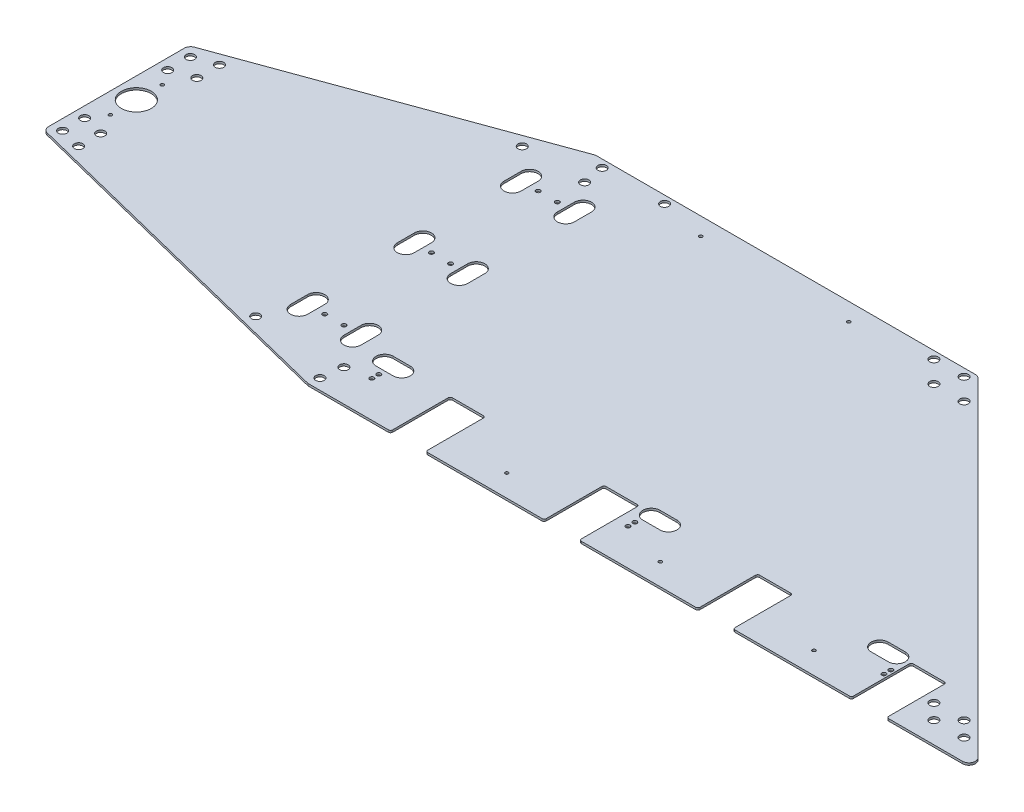
from build123d import *

# Parameters (mm, degrees)
SKETCH2_R                   = 6.35
SKETCH2_R_2                 = 2.45745
BOSS_EXTRUDE1_DEPTH         = 3.175
FILLET1_R                   = 3.175
CUT_EXTRUDE1_DEPTH          = 6.35
F_1_4_0_25_DIAMETER_HOLE1_D = 6.35
SKETCH8_R                   = 22.225
CUT_EXTRUDE2_DEPTH          = 1107.912948355
F_1_4_0_25_DIAMETER_HOLE2_D = 6.35
SKETCH12_R                  = 2.45745
SKETCH12_R_2                = 3.175
CUT_EXTRUDE3_DEPTH          = 1107.912948355


with BuildPart() as part:
    # Sketch2 → Boss-Extrude1 (new body)
    with BuildSketch(Plane(origin=(0, 0, 0), x_dir=(1, 0, 0), z_dir=(0, 1, 0))):
        with BuildLine():
            ThreePointArc((-523.9004, 138.064786013), (-521.881202428, 132.200610461), (-516.679706056, 128.82271922))
            Line((-516.679706056, 128.82271922), (-1.134783113, 0.282933207))
            ThreePointArc((-1.134783113, 0.282933207), (0.008717447, 0.070997906), (1.169522943, 0))
            Line((1.169522943, 0), (122.844814136, 0))
            Line((122.844814136, 0), (122.844814136, 88.9))
            Line((122.844814136, 88.9), (175.168814136, 88.9))
            Line((175.168814136, 88.9), (175.168814136, 0))
            Line((175.168814136, 0), (351.444814136, 0))
            Line((351.444814136, 0), (351.444814136, 88.9))
            Line((351.444814136, 88.9), (403.768814136, 88.9))
            Line((403.768814136, 88.9), (403.768814136, 0))
            Line((403.768814136, 0), (580.044814136, 0))
            Line((580.044814136, 0), (580.044814136, 88.9))
            Line((580.044814136, 88.9), (632.368814136, 88.9))
            Line((632.368814136, 88.9), (632.368814136, 0))
            Line((632.368814136, 0), (808.644814136, 0))
            Line((808.644814136, 0), (808.644814136, 88.9))
            Line((808.644814136, 88.9), (860.968814136, 88.9))
            Line((860.968814136, 88.9), (860.968814136, 0))
            Line((860.968814136, 0), (973.929215818, 0))
            ThreePointArc((973.929215818, 0), (982.729168366, 5.879940307), (980.664407909, 16.260192091))
            Line((980.664407909, 16.260192091), (491.714407909, 505.210192091))
            ThreePointArc((491.714407909, 505.210192091), (488.624275512, 507.274952547), (484.979215818, 508))
            Line((484.979215818, 508), (-78.566585303, 508))
            ThreePointArc((-78.566585303, 508), (-80.220584195, 507.855293847), (-81.824327168, 507.425572213))
            Line((-81.824327168, 507.425572213), (-517.633141865, 348.804135832))
            ThreePointArc((-517.633141865, 348.804135832), (-522.177823222, 345.316879176), (-523.9004, 339.853563619))
            Line((-523.9004, 339.853563619), (-523.9004, 138.064786013))
        make_face()
        with Locations(Location((1.976178059, 15.875, 0), (0, 0, 270))):
            Circle(SKETCH2_R, mode=Mode.SUBTRACT)
        with Locations(Location((-125.36611658, 47.625, 0), (0, 0, 270))):
            Circle(SKETCH2_R, mode=Mode.SUBTRACT)
        with Locations(Location((5.874587868, 47.625, 0), (0, 0, 270))):
            Circle(SKETCH2_R, mode=Mode.SUBTRACT)
        with Locations(Location((-476.2754, 135.116510814, 0), (0, 0, 270))):
            Circle(SKETCH2_R, mode=Mode.SUBTRACT)
        with Locations(Location((-508.0254, 143.032674904, 0), (0, 0, 270))):
            Circle(SKETCH2_R, mode=Mode.SUBTRACT)
        with Locations(Location((-476.2754, 167.838493546, 0), (0, 0, 270))):
            Circle(SKETCH2_R, mode=Mode.SUBTRACT)
        with Locations(Location((-508.0254, 175.754657636, 0), (0, 0, 270))):
            Circle(SKETCH2_R, mode=Mode.SUBTRACT)
        with Locations(Location((-493.0394, 199.090929312, 0), (0, 0, 270))):
            Circle(SKETCH2_R_2, mode=Mode.SUBTRACT)
        with Locations(Location((263.306814136, 32.385, 0), (0, 0, 270))):
            Circle(SKETCH2_R_2, mode=Mode.SUBTRACT)
        with Locations(Location((491.906814136, 32.385, 0), (0, 0, 270))):
            Circle(SKETCH2_R_2, mode=Mode.SUBTRACT)
        with Locations(Location((720.506814136, 32.385, 0), (0, 0, 270))):
            Circle(SKETCH2_R_2, mode=Mode.SUBTRACT)
        with Locations(Location((877.339781319, 53.975, 0), (0, 0, 270))):
            Circle(SKETCH2_R, mode=Mode.SUBTRACT)
        with Locations(Location((899.564781319, 31.75, 0), (0, 0, 270))):
            Circle(SKETCH2_R, mode=Mode.SUBTRACT)
        with Locations(Location((944.466061924, 31.75, 0), (0, 0, 270))):
            Circle(SKETCH2_R, mode=Mode.SUBTRACT)
        with Locations(Location((922.241061924, 53.975, 0), (0, 0, 270))):
            Circle(SKETCH2_R, mode=Mode.SUBTRACT)
        with Locations(Location((-493.0394, 276.290731215, 0), (0, 0, 270))):
            Circle(SKETCH2_R_2, mode=Mode.SUBTRACT)
        with Locations(Location((-508.0254, 299.333610137, 0), (0, 0, 270))):
            Circle(SKETCH2_R, mode=Mode.SUBTRACT)
        with Locations(Location((-476.2754, 310.889665075, 0), (0, 0, 270))):
            Circle(SKETCH2_R, mode=Mode.SUBTRACT)
        with Locations(Location((-508.0254, 333.121254413, 0), (0, 0, 270))):
            Circle(SKETCH2_R, mode=Mode.SUBTRACT)
        with Locations(Location((-476.2754, 344.677309351, 0), (0, 0, 270))):
            Circle(SKETCH2_R, mode=Mode.SUBTRACT)
        with Locations(Location((-146.038641871, 464.873096997, 0), (0, 0, 270))):
            Circle(SKETCH2_R, mode=Mode.SUBTRACT)
        with Locations(Location((-53.207852166, 464.873081124, 0), (0, 0, 270))):
            Circle(SKETCH2_R, mode=Mode.SUBTRACT)
        with Locations(Location((-58.806228375, 496.623082082, 0), (0, 0, 270))):
            Circle(SKETCH2_R, mode=Mode.SUBTRACT)
        with Locations(Location((34.024561331, 496.623066209, 0), (0, 0, 270))):
            Circle(SKETCH2_R, mode=Mode.SUBTRACT)
        with Locations(Location((102.750499745, 481.637016811, 0), (0, 0, 270))):
            Circle(SKETCH2_R_2, mode=Mode.SUBTRACT)
        with Locations(Location((322.928740552, 481.637016811, 0), (0, 0, 270))):
            Circle(SKETCH2_R_2, mode=Mode.SUBTRACT)
        with Locations(Location((466.441944838, 464.872992272, 0), (0, 0, 270))):
            Circle(SKETCH2_R, mode=Mode.SUBTRACT)
        with Locations(Location((511.343225443, 464.872984595, 0), (0, 0, 270))):
            Circle(SKETCH2_R, mode=Mode.SUBTRACT)
        with Locations(Location((434.691950267, 496.622997701, 0), (0, 0, 270))):
            Circle(SKETCH2_R, mode=Mode.SUBTRACT)
        with Locations(Location((479.593230872, 496.622990024, 0), (0, 0, 270))):
            Circle(SKETCH2_R, mode=Mode.SUBTRACT)
    extrude(amount=BOSS_EXTRUDE1_DEPTH)

    # Fillet1
    fillet1_edges = [part.edges().sort_by_distance(p)[0] for p in [
        (860.968814136, 1.5875, 0),
        (860.968814136, 1.5875, -88.9),
        (808.644814136, 1.5875, -88.9),
        (808.644814136, 1.5875, 0),
        (632.368814136, 1.5875, 0),
        (632.368814136, 1.5875, -88.9),
        (580.044814136, 1.5875, -88.9),
        (580.044814136, 1.5875, 0),
        (403.768814136, 1.5875, 0),
        (403.768814136, 1.5875, -88.9),
        (351.444814136, 1.5875, -88.9),
        (351.444814136, 1.5875, 0),
        (175.168814136, 1.5875, 0),
        (175.168814136, 1.5875, -88.9),
        (122.844814136, 1.5875, -88.9),
        (122.844814136, 1.5875, 0),
    ]]
    fillet(fillet1_edges, radius=FILLET1_R)

    # Sketch6 → Cut-Extrude1 (cut)
    with BuildSketch(Plane(origin=(0, 3.175, 0), x_dir=(1, 0, 0), z_dir=(0, 1, 0))):
        with BuildLine():
            Line((-9.959198014, 431.8127), (-9.959198014, 406.4127))
            ThreePointArc((-9.959198014, 406.4127), (-22.659198014, 393.7127), (-35.359198014, 406.4127))
            Line((-35.359198014, 406.4127), (-35.359198014, 431.8127))
            ThreePointArc((-35.359198014, 431.8127), (-22.659198014, 444.5127), (-9.959198014, 431.8127))
        make_face()
        with BuildLine():
            Line((-89.334198014, 431.8127), (-89.334198014, 406.4127))
            ThreePointArc((-89.334198014, 406.4127), (-102.034198014, 393.7127), (-114.734198014, 406.4127))
            Line((-114.734198014, 406.4127), (-114.734198014, 431.8127))
            ThreePointArc((-114.734198014, 431.8127), (-102.034198014, 444.5127), (-89.334198014, 431.8127))
        make_face()
        with BuildLine():
            Line((-9.959198014, 273.0627), (-9.959198014, 247.6627))
            ThreePointArc((-9.959198014, 247.6627), (-22.659198014, 234.9627), (-35.359198014, 247.6627))
            Line((-35.359198014, 247.6627), (-35.359198014, 273.0627))
            ThreePointArc((-35.359198014, 273.0627), (-22.659198014, 285.7627), (-9.959198014, 273.0627))
        make_face()
        with BuildLine():
            Line((-89.334198014, 273.0627), (-89.334198014, 247.6627))
            ThreePointArc((-89.334198014, 247.6627), (-102.034198014, 234.9627), (-114.734198014, 247.6627))
            Line((-114.734198014, 247.6627), (-114.734198014, 273.0627))
            ThreePointArc((-114.734198014, 273.0627), (-102.034198014, 285.7627), (-89.334198014, 273.0627))
        make_face()
        with BuildLine():
            Line((-9.959198014, 114.3127), (-9.959198014, 88.9127))
            ThreePointArc((-9.959198014, 88.9127), (-22.659198014, 76.2127), (-35.359198014, 88.9127))
            Line((-35.359198014, 88.9127), (-35.359198014, 114.3127))
            ThreePointArc((-35.359198014, 114.3127), (-22.659198014, 127.0127), (-9.959198014, 114.3127))
        make_face()
        with BuildLine():
            Line((-89.334198014, 114.3127), (-89.334198014, 88.9127))
            ThreePointArc((-89.334198014, 88.9127), (-102.034198014, 76.2127), (-114.734198014, 88.9127))
            Line((-114.734198014, 88.9127), (-114.734198014, 114.3127))
            ThreePointArc((-114.734198014, 114.3127), (-102.034198014, 127.0127), (-89.334198014, 114.3127))
        make_face()
    extrude(amount=-CUT_EXTRUDE1_DEPTH, mode=Mode.SUBTRACT)

    # 1/4 (0.25) Diameter Hole1 (through all)
    with Locations(Plane(origin=(-48.059198014, 3.175, -419.1127), x_dir=(0, 0, 1), z_dir=(0, 1, 0))):
        with Locations((0, 0), (0, -28.575), (158.75, -28.575), (158.75, 0), (317.5, 0), (317.5, -28.575)):
            Hole(F_1_4_0_25_DIAMETER_HOLE1_D / 2)

    # Sketch8 → Cut-Extrude2 (cut, through all)
    with BuildSketch(Plane(origin=(0, 3.175, 0), x_dir=(1, 0, 0), z_dir=(0, 1, 0))):
        with Locations(Location((-493.0394, 237.690830263, 0), (0, 0, 270))):
            Circle(SKETCH8_R)
    extrude(amount=-CUT_EXTRUDE2_DEPTH, mode=Mode.SUBTRACT)

    # 1/4 (0.25) Diameter Hole2 (through all)
    with Locations(Plane(origin=(0, 3.175, 0), x_dir=(1, 0, 0), z_dir=(0, 1, 0))):
        with Locations((41.056814136, 53.975), (422.056814136, 53.975), (803.056814136, 53.975), (41.056814136, 64.29375), (422.056814136, 64.29375), (803.056814136, 64.29375)):
            Hole(F_1_4_0_25_DIAMETER_HOLE2_D / 2)

    # Sketch12 → Cut-Extrude3 (cut, through all)
    with BuildSketch(Plane(origin=(0, 3.175, 0), x_dir=(1, 0, 0), z_dir=(0, 1, 0))):
        with Locations(Location((720.506814136, 32.385, 0), (0, 0, 270))):
            Circle(SKETCH12_R)
        with Locations(Location((491.906814136, 32.385, 0), (0, 0, 270))):
            Circle(SKETCH12_R)
        with Locations(Location((263.306814136, 32.385, 0), (0, 0, 270))):
            Circle(SKETCH12_R)
        with Locations(Location((41.056814136, 53.975, 0), (0, 0, 270))):
            Circle(SKETCH12_R_2)
        with Locations(Location((422.056814136, 53.975, 0), (0, 0, 270))):
            Circle(SKETCH12_R_2)
        with Locations(Location((803.056814136, 53.975, 0), (0, 0, 270))):
            Circle(SKETCH12_R_2)
        with BuildLine():
            Line((28.356814136, 98.425), (53.756814136, 98.425))
            ThreePointArc((53.756814136, 98.425), (66.456814136, 85.725), (53.756814136, 73.025))
            Line((53.756814136, 73.025), (28.356814136, 73.025))
            ThreePointArc((28.356814136, 73.025), (15.656814136, 85.725), (28.356814136, 98.425))
        make_face()
        with BuildLine():
            Line((425.231814136, 98.425), (450.631814136, 98.425))
            ThreePointArc((450.631814136, 98.425), (463.331814136, 85.725), (450.631814136, 73.025))
            Line((450.631814136, 73.025), (425.231814136, 73.025))
            ThreePointArc((425.231814136, 73.025), (412.531814136, 85.725), (425.231814136, 98.425))
        make_face()
        with BuildLine():
            Line((764.956814136, 98.425), (790.356814136, 98.425))
            ThreePointArc((790.356814136, 98.425), (803.056814136, 85.725), (790.356814136, 73.025))
            Line((790.356814136, 73.025), (764.956814136, 73.025))
            ThreePointArc((764.956814136, 73.025), (752.256814136, 85.725), (764.956814136, 98.425))
        make_face()
    extrude(amount=-CUT_EXTRUDE3_DEPTH, mode=Mode.SUBTRACT)


solid = part.part
